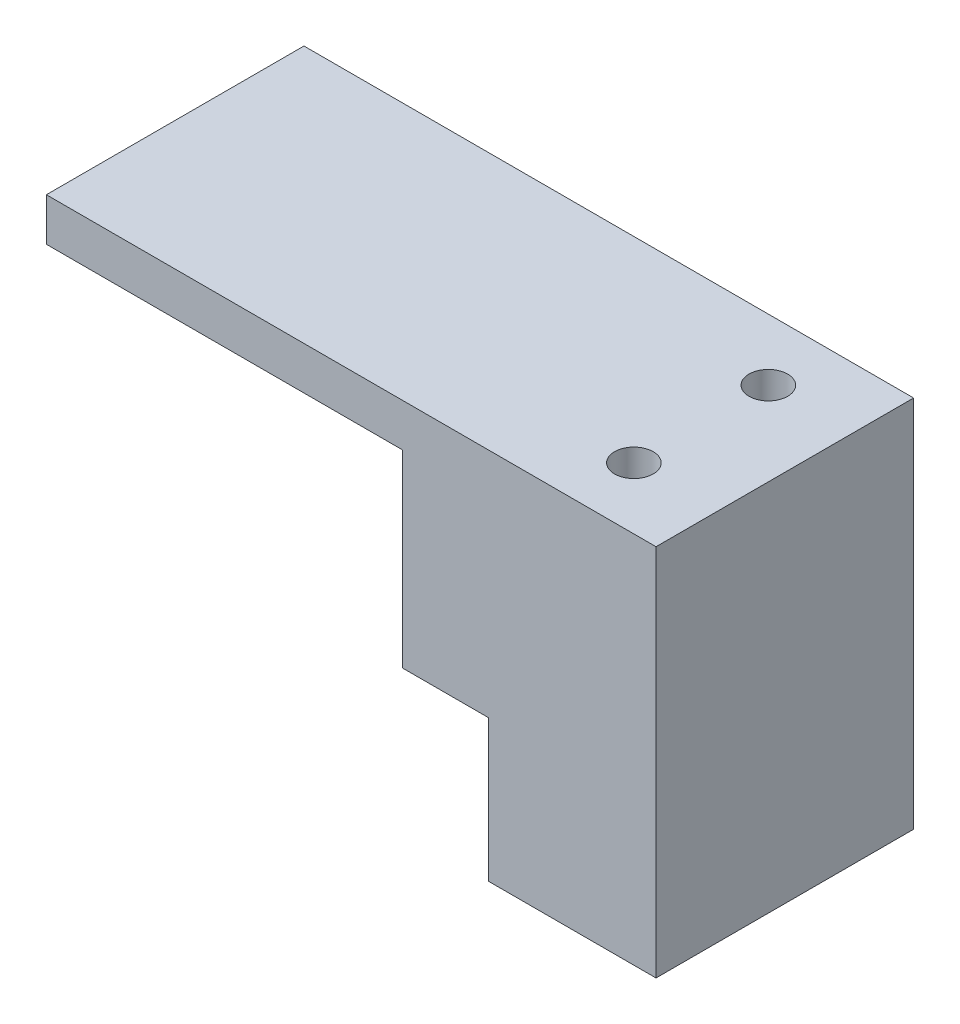
from build123d import *

# Parameters (mm, degrees)
SKETCH1_W           = 19.5
SKETCH1_H           = 30
SKETCH1_R           = 2.25
BOSS_EXTRUDE1_DEPTH = 16.5
SKETCH2_R           = 2.25
BOSS_EXTRUDE2_DEPTH = 22
SKETCH3_R           = 2.25
BOSS_EXTRUDE3_DEPTH = 5


with BuildPart() as part:
    # Sketch1 → Boss-Extrude1 (new body)
    with BuildSketch(Plane(origin=(0, 0, 0), x_dir=(1, 0, 0), z_dir=(0, 1, 0))):
        with Locations((9.75, 15)):
            Rectangle(SKETCH1_W, SKETCH1_H)
        with Locations(Location((9.75, 22.830092663, 0), (0, 0, 270))):
            Circle(SKETCH1_R, mode=Mode.SUBTRACT)
        with Locations(Location((9.75, 7.169907337, 0), (0, 0, 270))):
            Circle(SKETCH1_R, mode=Mode.SUBTRACT)
    extrude(amount=BOSS_EXTRUDE1_DEPTH)

    # Sketch2 → Boss-Extrude2 (add)
    with BuildSketch(Plane(origin=(0, 16.5, 0), x_dir=(1, 0, 0), z_dir=(0, 1, 0))):
        Polygon((0, 30), (-10, 30), (-10, 0), (0, 0), (19.5, 0), (19.5, 30), align=None)
        with Locations(Location((9.75, 22.830092663, 0), (0, 0, 270))):
            Circle(SKETCH2_R, mode=Mode.SUBTRACT)
        with Locations(Location((9.75, 7.169907337, 0), (0, 0, 270))):
            Circle(SKETCH2_R, mode=Mode.SUBTRACT)
    extrude(amount=BOSS_EXTRUDE2_DEPTH)

    # Sketch3 → Boss-Extrude3 (add)
    with BuildSketch(Plane(origin=(0, 38.5, 0), x_dir=(1, 0, 0), z_dir=(0, 1, 0))):
        Polygon((-10, 30), (-51.5, 30), (-51.5, 0), (-10, 0), (19.5, 0), (19.5, 30), align=None)
        with Locations(Location((9.75, 22.830092663, 0), (0, 0, 270))):
            Circle(SKETCH3_R, mode=Mode.SUBTRACT)
        with Locations(Location((9.75, 7.169907337, 0), (0, 0, 270))):
            Circle(SKETCH3_R, mode=Mode.SUBTRACT)
    extrude(amount=BOSS_EXTRUDE3_DEPTH)


solid = part.part
